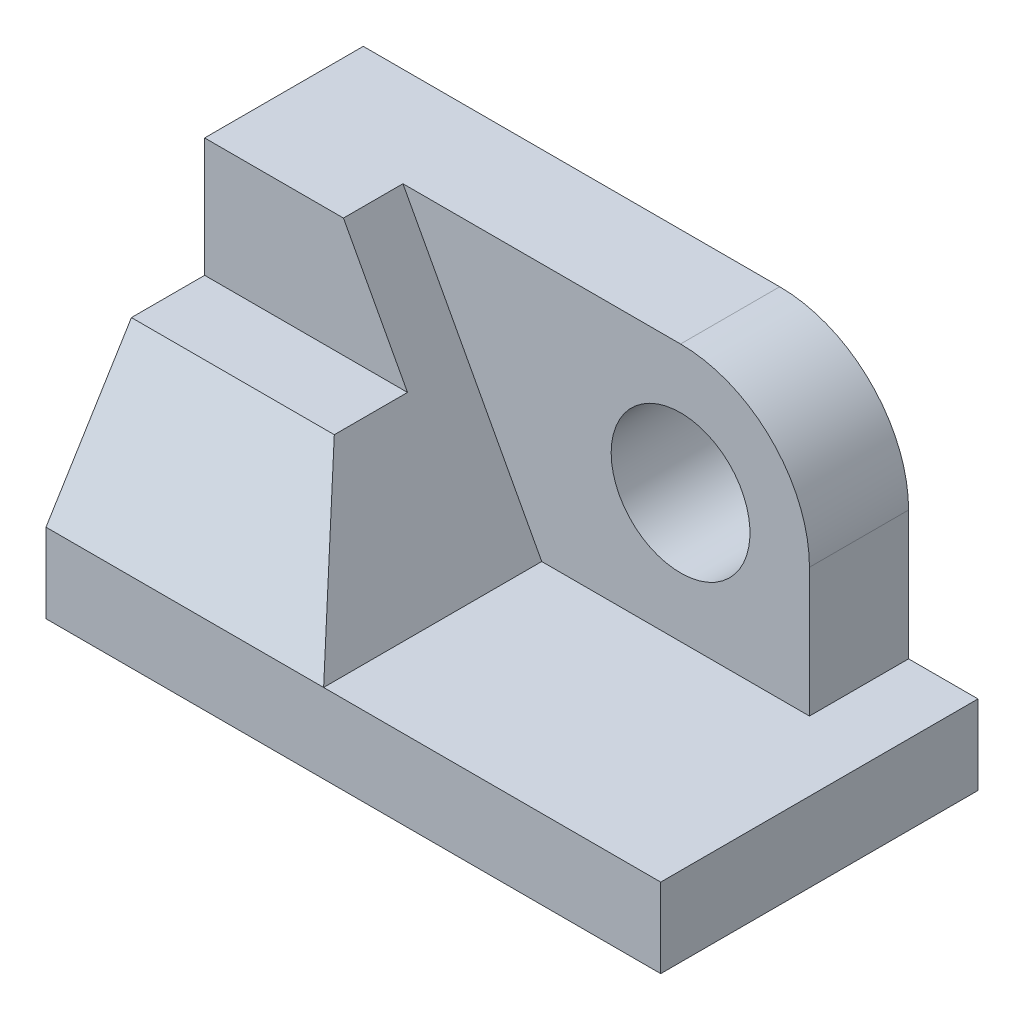
from build123d import *

# Parameters (mm, degrees)
SKETCH_1_W          = 62
SKETCH_1_H          = 32
EXTRUDE_1_DEPTH     = 8
SKETCH_2_R          = 7
EXTRUDE_2_DEPTH     = 10
SKETCH_6_W          = 21.388804526
SKETCH_6_H          = 8.444348029
CUT_EXTRUDE_1_DEPTH = 42.243181422


with BuildPart() as part:
    # 草图1 → 凸台-拉伸1 (new body)
    with BuildSketch(Plane(origin=(0, 0, 0), x_dir=(1, 0, 0), z_dir=(0, 1, 0))):
        Rectangle(SKETCH_1_W, SKETCH_1_H)
    extrude(amount=EXTRUDE_1_DEPTH)

    # 草图2 → 凸台-拉伸2 (add)
    with BuildSketch(Plane(origin=(0, 0, -16), x_dir=(-1, 0, 0), z_dir=(0, 0, -1))):
        with BuildLine():
            Line((-24, 21), (-24, 8))
            Line((-24, 8), (31, 8))
            Line((31, 8), (31, 34))
            Line((31, 34), (-11, 34))
            ThreePointArc((-11, 34), (-20.192388155, 30.192388155), (-24, 21))
        make_face()
        with Locations((-11, 21)):
            Circle(SKETCH_2_R, mode=Mode.SUBTRACT)
    extrude(amount=-EXTRUDE_2_DEPTH)

    # 草图5 → 放样1 section 0
    with BuildSketch(Plane(origin=(0, 8, 0), x_dir=(1, 0, 0), z_dir=(0, 1, 0))):
        with BuildLine():
            Line((-3, -16), (-3, 6))
            Line((-3, 6), (-31, 6))
            Line((-31, 6), (-31, -16))
            Line((-31, -16), (-3, -16))
        make_face()
    # 草图4 → 放样1 section 1
    with BuildSketch(Plane(origin=(0, 34, 0), x_dir=(1, 0, 0), z_dir=(0, 1, 0))):
        with BuildLine():
            Line((-31, 6), (-31, 0))
            Line((-31, 0), (-17, 0))
            Line((-17, 0), (-17, 6))
            Line((-17, 6), (-31, 6))
        make_face()
    loft()

    # 草图6 → 切除-拉伸1 (cut, through all)
    with BuildSketch(Plane(origin=(0, 22, 0), x_dir=(1, 0, 0), z_dir=(0, 1, 0))):
        with Locations((-20.305597737, -4.222174015)):
            Rectangle(SKETCH_6_W, SKETCH_6_H)
    extrude(amount=CUT_EXTRUDE_1_DEPTH, mode=Mode.SUBTRACT)


solid = part.part
